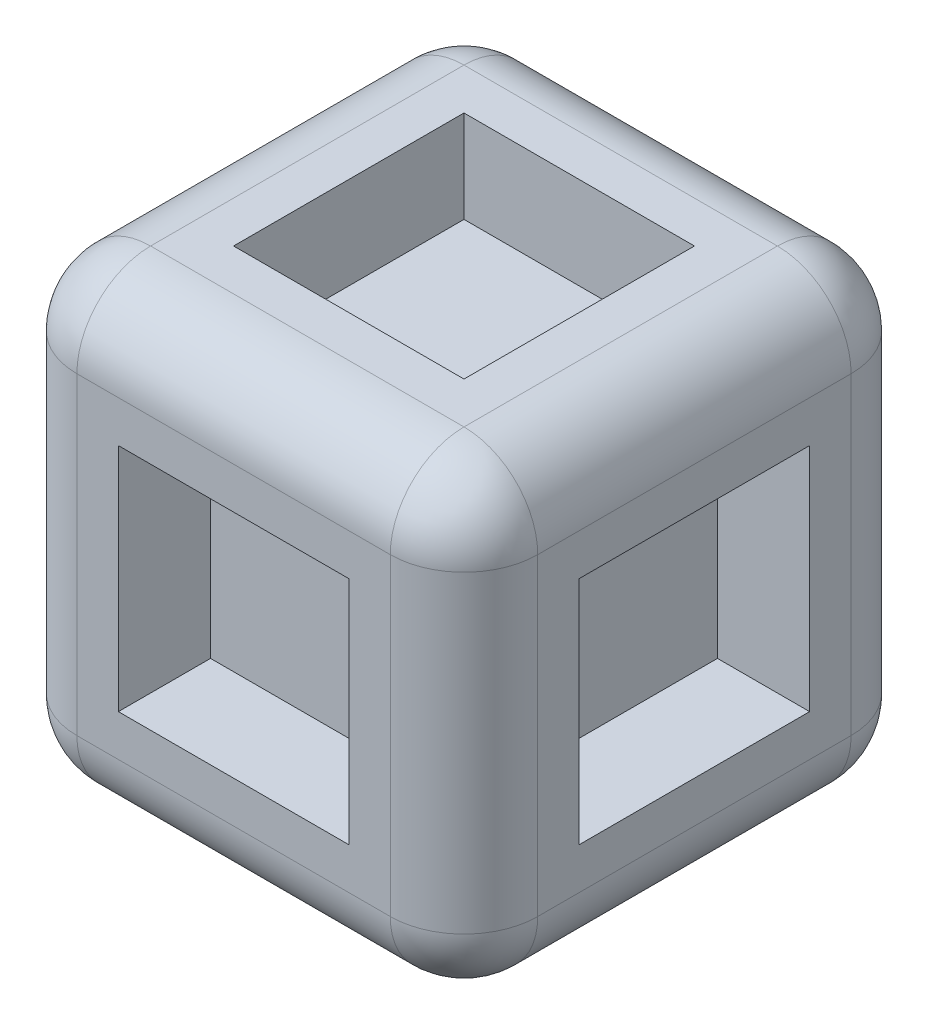
from build123d import *

# Parameters (mm, degrees)
SKETCH1_W           = 25
SKETCH1_H           = 25
SKETCH1_W_2         = 12.5
SKETCH1_H_2         = 12.5
BOSS_EXTRUDE1_DEPTH = 12.5
SKETCH2_W           = 12.5
SKETCH2_H           = 12.5
CUT_EXTRUDE1_DEPTH  = 5
SKETCH3_W           = 12.5
SKETCH3_H           = 12.5
CUT_EXTRUDE2_DEPTH  = 5
SKETCH4_W           = 12.5
SKETCH4_H           = 12.5
CUT_EXTRUDE3_DEPTH  = 5
FILLET1_R           = 4


with BuildPart() as part:
    # Sketch1 → Boss-Extrude1 (new, symmetric)
    # profile 1 of 2: a face of its own
    with BuildSketch(Plane.XY):
        Rectangle(SKETCH1_W, SKETCH1_H)
        Rectangle(SKETCH1_W_2, SKETCH1_H_2, mode=Mode.SUBTRACT)
    # profile 2 of 2: a face of its own
    with BuildSketch(Plane.XY):
        Rectangle(SKETCH1_W_2, SKETCH1_H_2)
    extrude(amount=BOSS_EXTRUDE1_DEPTH, both=True)

    # Sketch2 → Cut-Extrude1 (cut)
    with BuildSketch(Plane(origin=(0, 0, -12.5), x_dir=(-1, 0, 0), z_dir=(0, 0, -1))):
        Rectangle(SKETCH2_W, SKETCH2_H)
    cut_extrude1 = extrude(amount=-CUT_EXTRUDE1_DEPTH, mode=Mode.SUBTRACT)

    # Mirror1: Cut-Extrude1 across plane
    add(cut_extrude1.mirror(Plane.XY), mode=Mode.SUBTRACT)

    # Sketch3 → Cut-Extrude2 (cut)
    with BuildSketch(Plane(origin=(0, 12.5, 0), x_dir=(1, 0, 0), z_dir=(0, 1, 0))):
        Rectangle(SKETCH3_W, SKETCH3_H)
    cut_extrude2 = extrude(amount=-CUT_EXTRUDE2_DEPTH, mode=Mode.SUBTRACT)

    # Sketch4 → Cut-Extrude3 (cut)
    with BuildSketch(Plane(origin=(12.5, 0, 0), x_dir=(0, 0, -1), z_dir=(1, 0, 0))):
        Rectangle(SKETCH4_W, SKETCH4_H)
    cut_extrude3 = extrude(amount=-CUT_EXTRUDE3_DEPTH, mode=Mode.SUBTRACT)

    # Mirror2: Cut-Extrude3 across plane
    add(cut_extrude3.mirror(Plane(origin=(0, 0, 0), x_dir=(0, 0, 1), z_dir=(1, 0, 0))), mode=Mode.SUBTRACT)

    # Mirror3: Cut-Extrude2 across plane
    add(cut_extrude2.mirror(Plane.ZX), mode=Mode.SUBTRACT)

    # Fillet1
    fillet1_edges = [part.edges().sort_by_distance(p)[0] for p in [
        (0, 12.5, 12.5),
        (-12.5, 0, 12.5),
        (0, -12.5, 12.5),
        (12.5, 0, 12.5),
        (0, -12.5, -12.5),
        (-12.5, 0, -12.5),
        (0, 12.5, -12.5),
        (12.5, 0, -12.5),
        (12.5, -12.5, 0),
        (-12.5, -12.5, 0),
        (-12.5, 12.5, 0),
        (12.5, 12.5, 0),
    ]]
    fillet(fillet1_edges, radius=FILLET1_R)


solid = part.part
